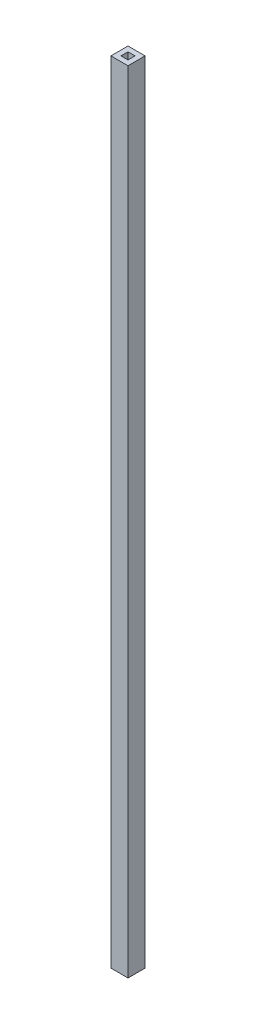
from build123d import *

# Parameters (mm, degrees)
SKETCH1_W           = 50.8
SKETCH1_H           = 50.8
SKETCH1_W_2         = 20.8
SKETCH1_H_2         = 20.8
BOSS_EXTRUDE1_DEPTH = 2346.325


with BuildPart() as part:
    # Sketch1 → Boss-Extrude1 (new body)
    with BuildSketch(Plane(origin=(0, 0, 0), x_dir=(1, 0, 0), z_dir=(0, 1, 0))):
        Rectangle(SKETCH1_W, SKETCH1_H)
        Rectangle(SKETCH1_W_2, SKETCH1_H_2, mode=Mode.SUBTRACT)
    extrude(amount=BOSS_EXTRUDE1_DEPTH)


solid = part.part
